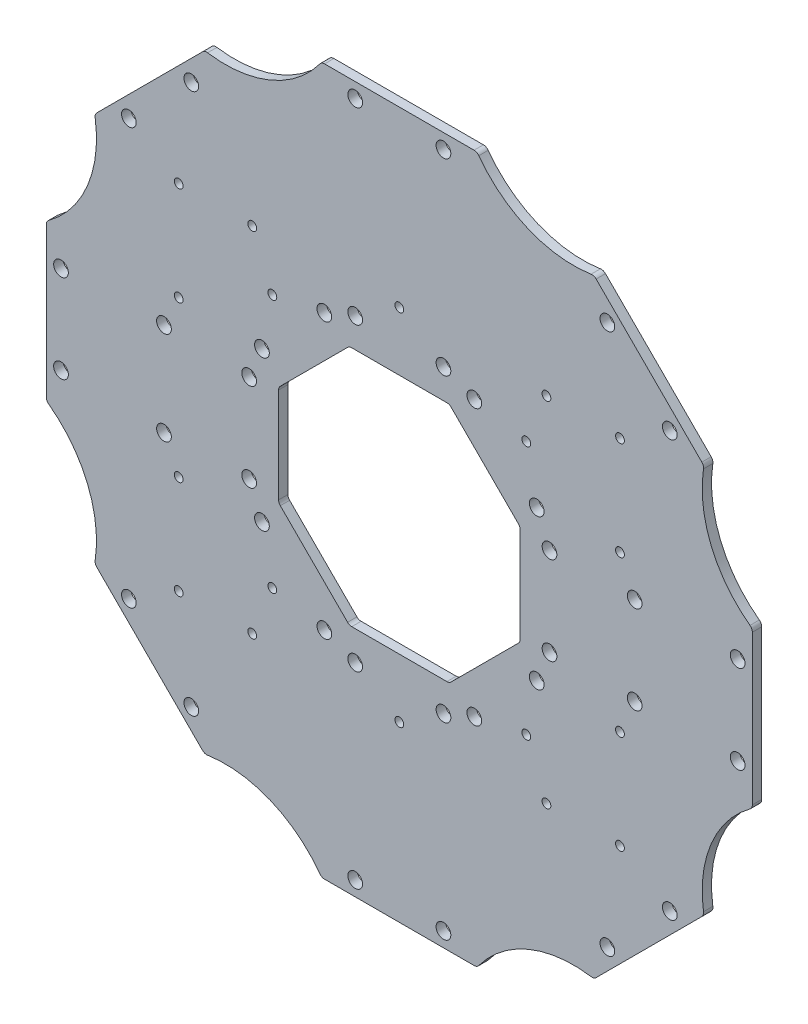
from build123d import *

# Parameters (mm, degrees)
SKETCH1_R           = 2.5
SKETCH1_R_2         = 1.5
BOSS_EXTRUDE2_DEPTH = 3.175
FILLET2_R           = 2


with BuildPart() as part:
    # Sketch1 → Boss-Extrude2 (new body)
    with BuildSketch(Plane.XY):
        with BuildLine():
            Line((-120, 26.433190344), (-120, -26.433190344))
            ThreePointArc((-120, -26.433190344), (-105.978758658, -43.899668257), (-103.544901199, -66.165098801))
            Line((-103.544901199, -66.165098801), (-66.165098801, -103.544901199))
            ThreePointArc((-66.165098801, -103.544901199), (-43.899668257, -105.978758658), (-26.433190344, -120))
            Line((-26.433190344, -120), (26.433190344, -120))
            ThreePointArc((26.433190344, -120), (43.899668257, -105.978758658), (66.165098801, -103.544901199))
            Line((66.165098801, -103.544901199), (103.544901199, -66.165098801))
            ThreePointArc((103.544901199, -66.165098801), (105.978758658, -43.899668257), (120, -26.433190344))
            Line((120, -26.433190344), (120, 26.433190344))
            ThreePointArc((120, 26.433190344), (105.978758658, 43.899668257), (103.544901199, 66.165098801))
            Line((103.544901199, 66.165098801), (66.165098801, 103.544901199))
            ThreePointArc((66.165098801, 103.544901199), (43.899668257, 105.978758658), (26.433190344, 120))
            Line((26.433190344, 120), (-26.433190344, 120))
            ThreePointArc((-26.433190344, 120), (-43.899668257, 105.978758658), (-66.165098801, 103.544901199))
            Line((-66.165098801, 103.544901199), (-103.544901199, 66.165098801))
            ThreePointArc((-103.544901199, 66.165098801), (-105.978758658, 43.899668257), (-120, 26.433190344))
        make_face()
        with Locations((-91.926067812, 70.712864376)):
            Circle(SKETCH1_R, mode=Mode.SUBTRACT)
        with Locations((-70.712864376, 91.926067812)):
            Circle(SKETCH1_R, mode=Mode.SUBTRACT)
        with Locations((-25.485281374, 46.69848481)):
            Circle(SKETCH1_R, mode=Mode.SUBTRACT)
        with Locations((-46.69848481, 25.485281374)):
            Circle(SKETCH1_R, mode=Mode.SUBTRACT)
        with Locations((-15, 115)):
            Circle(SKETCH1_R, mode=Mode.SUBTRACT)
        with Locations((-15, 51.04163056)):
            Circle(SKETCH1_R, mode=Mode.SUBTRACT)
        with Locations((-115, 15)):
            Circle(SKETCH1_R, mode=Mode.SUBTRACT)
        with Locations((-51.04163056, 15)):
            Circle(SKETCH1_R, mode=Mode.SUBTRACT)
        with Locations((-75, 60)):
            Circle(SKETCH1_R_2, mode=Mode.SUBTRACT)
        with Locations((-50, 60)):
            Circle(SKETCH1_R_2, mode=Mode.SUBTRACT)
        with Locations((-43.162950904, 43.162950904)):
            Circle(SKETCH1_R_2, mode=Mode.SUBTRACT)
        with Locations((0, 61.04163056)):
            Circle(SKETCH1_R_2, mode=Mode.SUBTRACT)
        with Locations((-75, 26.433190344)):
            Circle(SKETCH1_R_2, mode=Mode.SUBTRACT)
        with Locations(Location((75, 26.433190344, 0), (0, 0, 180))):
            Circle(SKETCH1_R_2, mode=Mode.SUBTRACT)
        with Locations(Location((43.162950904, 43.162950904, 0), (0, 0, 180))):
            Circle(SKETCH1_R_2, mode=Mode.SUBTRACT)
        with Locations(Location((50, 60, 0), (0, 0, 180))):
            Circle(SKETCH1_R_2, mode=Mode.SUBTRACT)
        with Locations(Location((75, 60, 0), (0, 0, 180))):
            Circle(SKETCH1_R_2, mode=Mode.SUBTRACT)
        with Locations(Location((51.04163056, 15, 0), (0, 0, 180))):
            Circle(SKETCH1_R, mode=Mode.SUBTRACT)
        with Locations(Location((115, 15, 0), (0, 0, 180))):
            Circle(SKETCH1_R, mode=Mode.SUBTRACT)
        with Locations(Location((15, 51.04163056, 0), (0, 0, 180))):
            Circle(SKETCH1_R, mode=Mode.SUBTRACT)
        with Locations(Location((15, 115, 0), (0, 0, 180))):
            Circle(SKETCH1_R, mode=Mode.SUBTRACT)
        with Locations(Location((46.69848481, 25.485281374, 0), (0, 0, 180))):
            Circle(SKETCH1_R, mode=Mode.SUBTRACT)
        with Locations(Location((25.485281374, 46.69848481, 0), (0, 0, 180))):
            Circle(SKETCH1_R, mode=Mode.SUBTRACT)
        with Locations(Location((70.712864376, 91.926067812, 0), (0, 0, 180))):
            Circle(SKETCH1_R, mode=Mode.SUBTRACT)
        with Locations(Location((91.926067812, 70.712864376, 0), (0, 0, 180))):
            Circle(SKETCH1_R, mode=Mode.SUBTRACT)
        with Locations((91.926067812, -70.712864376)):
            Circle(SKETCH1_R, mode=Mode.SUBTRACT)
        with Locations((70.712864376, -91.926067812)):
            Circle(SKETCH1_R, mode=Mode.SUBTRACT)
        with Locations((25.485281374, -46.69848481)):
            Circle(SKETCH1_R, mode=Mode.SUBTRACT)
        with Locations((46.69848481, -25.485281374)):
            Circle(SKETCH1_R, mode=Mode.SUBTRACT)
        with Locations((15, -115)):
            Circle(SKETCH1_R, mode=Mode.SUBTRACT)
        with Locations((15, -51.04163056)):
            Circle(SKETCH1_R, mode=Mode.SUBTRACT)
        with Locations((115, -15)):
            Circle(SKETCH1_R, mode=Mode.SUBTRACT)
        with Locations((51.04163056, -15)):
            Circle(SKETCH1_R, mode=Mode.SUBTRACT)
        with Locations((75, -60)):
            Circle(SKETCH1_R_2, mode=Mode.SUBTRACT)
        with Locations((50, -60)):
            Circle(SKETCH1_R_2, mode=Mode.SUBTRACT)
        with Locations((43.162950904, -43.162950904)):
            Circle(SKETCH1_R_2, mode=Mode.SUBTRACT)
        with Locations((75, -26.433190344)):
            Circle(SKETCH1_R_2, mode=Mode.SUBTRACT)
        with Locations(Location((-75, -26.433190344, 0), (0, 0, 180))):
            Circle(SKETCH1_R_2, mode=Mode.SUBTRACT)
        with Locations(Location((0, -61.04163056, 0), (0, 0, 180))):
            Circle(SKETCH1_R_2, mode=Mode.SUBTRACT)
        with Locations(Location((-43.162950904, -43.162950904, 0), (0, 0, 180))):
            Circle(SKETCH1_R_2, mode=Mode.SUBTRACT)
        with Locations(Location((-50, -60, 0), (0, 0, 180))):
            Circle(SKETCH1_R_2, mode=Mode.SUBTRACT)
        with Locations(Location((-75, -60, 0), (0, 0, 180))):
            Circle(SKETCH1_R_2, mode=Mode.SUBTRACT)
        with Locations(Location((-51.04163056, -15, 0), (0, 0, 180))):
            Circle(SKETCH1_R, mode=Mode.SUBTRACT)
        with Locations(Location((-115, -15, 0), (0, 0, 180))):
            Circle(SKETCH1_R, mode=Mode.SUBTRACT)
        with Locations(Location((-15, -51.04163056, 0), (0, 0, 180))):
            Circle(SKETCH1_R, mode=Mode.SUBTRACT)
        with Locations(Location((-15, -115, 0), (0, 0, 180))):
            Circle(SKETCH1_R, mode=Mode.SUBTRACT)
        with Locations(Location((-46.69848481, -25.485281374, 0), (0, 0, 180))):
            Circle(SKETCH1_R, mode=Mode.SUBTRACT)
        with Locations(Location((-25.485281374, -46.69848481, 0), (0, 0, 180))):
            Circle(SKETCH1_R, mode=Mode.SUBTRACT)
        with Locations(Location((-70.712864376, -91.926067812, 0), (0, 0, 180))):
            Circle(SKETCH1_R, mode=Mode.SUBTRACT)
        with Locations(Location((-91.926067812, -70.712864376, 0), (0, 0, 180))):
            Circle(SKETCH1_R, mode=Mode.SUBTRACT)
        with Locations((-80, 15.849242405)):
            Circle(SKETCH1_R, mode=Mode.SUBTRACT)
        with Locations((-80, -15.849242405)):
            Circle(SKETCH1_R, mode=Mode.SUBTRACT)
        with Locations((80, -15)):
            Circle(SKETCH1_R, mode=Mode.SUBTRACT)
        with Locations((80, 15)):
            Circle(SKETCH1_R, mode=Mode.SUBTRACT)
        Polygon((-41.04163056, 17), (-17, 41.04163056), (17, 41.04163056), (41.04163056, 17), (41.04163056, -17), (17, -41.04163056), (-17, -41.04163056), (-41.04163056, -17), align=None, mode=Mode.SUBTRACT)
    extrude(amount=BOSS_EXTRUDE2_DEPTH)

    # Fillet2
    fillet2_edges = [part.edges().sort_by_distance(p)[0] for p in [
        (-26.433190344, 120, 1.5875),
        (26.433190344, 120, 1.5875),
        (66.165098801, 103.544901199, 1.5875),
        (103.544901199, 66.165098801, 1.5875),
        (120, 26.433190344, 1.5875),
        (120, -26.433190344, 1.5875),
        (103.544901199, -66.165098801, 1.5875),
        (66.165098801, -103.544901199, 1.5875),
        (26.433190344, -120, 1.5875),
        (-26.433190344, -120, 1.5875),
        (-66.165098801, -103.544901199, 1.5875),
        (-103.544901199, -66.165098801, 1.5875),
        (-120, -26.433190344, 1.5875),
        (-120, 26.433190344, 1.5875),
        (-103.544901199, 66.165098801, 1.5875),
        (-66.165098801, 103.544901199, 1.5875),
        (-41.04163056, 17, 1.5875),
        (-41.04163056, -17, 1.5875),
        (-17, -41.04163056, 1.5875),
        (17, -41.04163056, 1.5875),
        (41.04163056, -17, 1.5875),
        (41.04163056, 17, 1.5875),
        (17, 41.04163056, 1.5875),
        (-17, 41.04163056, 1.5875),
    ]]
    fillet(fillet2_edges, radius=FILLET2_R)


solid = part.part
